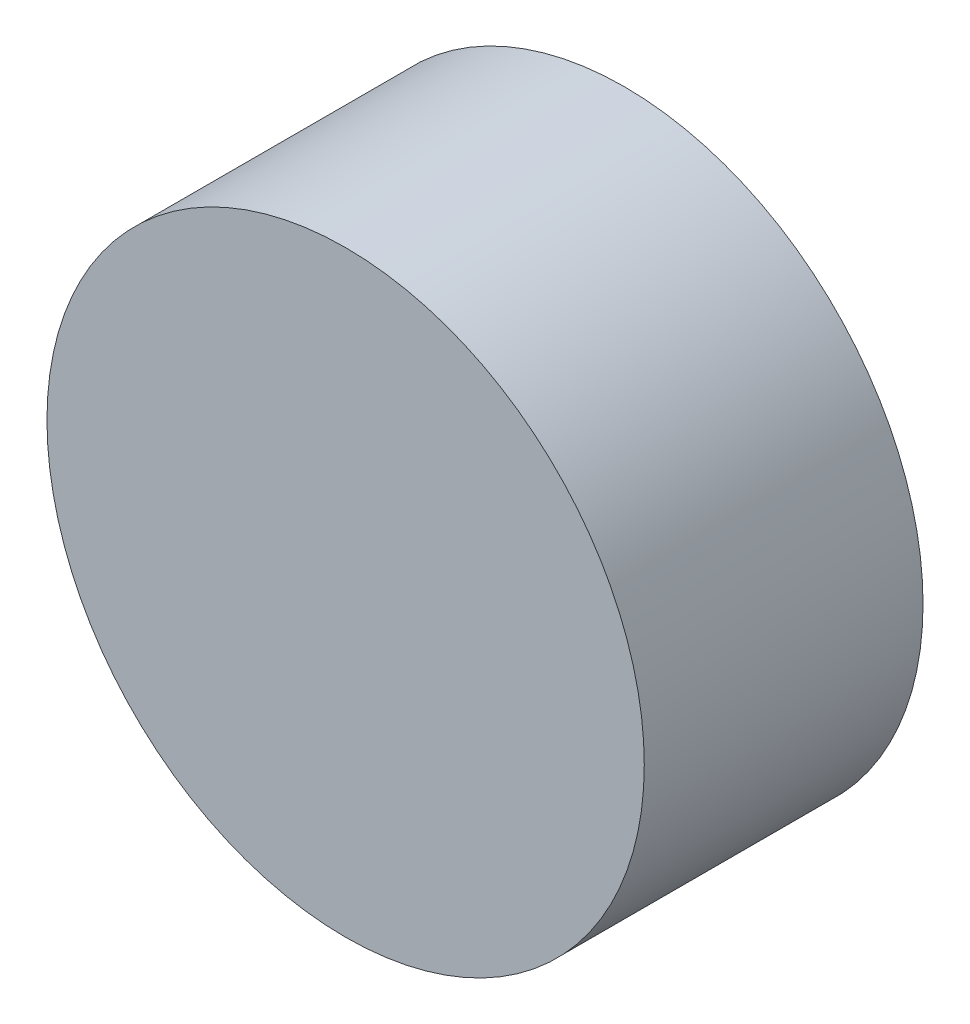
from build123d import *

# Parameters (mm, degrees)
SKETCH_1_R      = 60
EXTRUDE_1_DEPTH = 28


with BuildPart() as part:
    # 草图1 → 凸台-拉伸1 (new, symmetric)
    with BuildSketch(Plane.XY):
        Circle(SKETCH_1_R)
    extrude(amount=EXTRUDE_1_DEPTH, both=True)


solid = part.part
